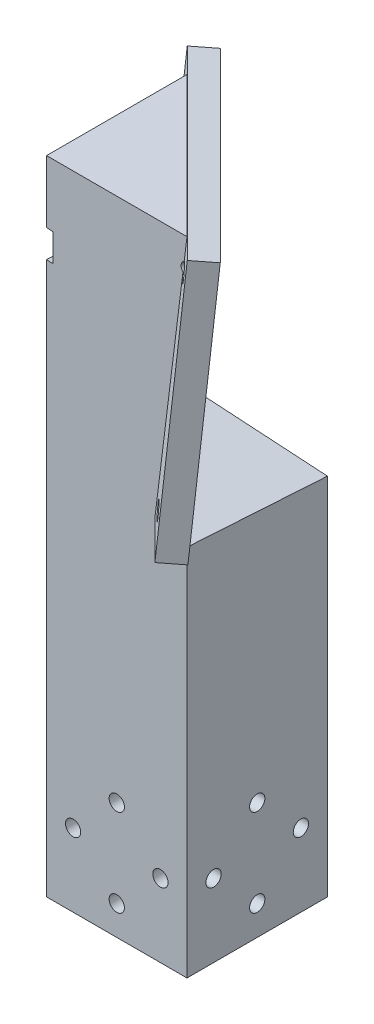
from build123d import *

# Parameters (mm, degrees)
SKETCH1_W               = 30.562599784
SKETCH1_H               = 30.562599784
BOSS_EXTRUDE1_DEPTH     = 139.7
CUT_EXTRUDE1_DEPTH      = 142.361685943
CUT_EXTRUDE1_DEPTH_BACK = 142.361685943
BOSS_EXTRUDE2_DEPTH     = 5.09983
SKETCH5_R               = 1.8
CUT_EXTRUDE2_DEPTH      = 146.354775845
SKETCH6_R               = 1.662500104
CUT_EXTRUDE3_DEPTH      = 145.138064655


with BuildPart() as part:
    # Sketch1 → Boss-Extrude1 (new body)
    with BuildSketch(Plane(origin=(0, 0, 0), x_dir=(1, 0, 0), z_dir=(0, 1, 0))):
        Rectangle(SKETCH1_W, SKETCH1_H)
    extrude(amount=BOSS_EXTRUDE1_DEPTH)

    # Sketch2 → Cut-Extrude1 (cut, two sides: drawn at the far end of the back side and taken through both)
    with BuildSketch(Plane(origin=(0, 0, 0), x_dir=(0.7071067811865477, 0, -0.7071067811865475), z_dir=(0.7071067811865475, 0, 0.7071067811865477)).offset(-CUT_EXTRUDE1_DEPTH_BACK)):
        Polygon((5.11931044, 139.7), (0, 81.186013921), (21.611021558, 79.295294527), (21.611021558, 139.7), align=None)
    extrude(amount=CUT_EXTRUDE1_DEPTH + CUT_EXTRUDE1_DEPTH_BACK, mode=Mode.SUBTRACT)

    # Sketch4 → Boss-Extrude2 (add)
    with BuildSketch(Plane(origin=(-4.984326181, 0.616698988, 4.984326181), x_dir=(-0.6990853645605906, 0.08649619246092877, -0.7097873355780225), z_dir=(0.704416026402759, -0.08715574274765817, -0.7044160264027586))):
        Polygon((-16.344826658, 141.568383735), (40.589342943, 136.606243895), (35.627203104, 79.672074294), (-21.306966498, 84.634214133), align=None)
    extrude(amount=-BOSS_EXTRUDE2_DEPTH)

    # Sketch5 → Cut-Extrude2 (cut, through all)
    with BuildSketch(Plane(origin=(-4.984326181, 0.616698988, 4.984326181), x_dir=(-0.6990853645605907, 0.08649619246092867, -0.7097873355780224), z_dir=(0.7044160264027588, -0.08715574274765812, -0.7044160264027586))):
        with Locations(Location((33.963841811, 130.554186497, 0), (0, 0, 355.018930606))):
            Circle(SKETCH5_R)
        with Locations(Location((-10.866212993, 134.461383221, 0), (0, 0, 355.018930606))):
            Circle(SKETCH5_R)
        with Locations(Location((-14.773409717, 89.631328416, 0), (0, 0, 355.018930606))):
            Circle(SKETCH5_R)
        with Locations(Location((30.056645087, 85.724131693, 0), (0, 0, 355.018930606))):
            Circle(SKETCH5_R)
        Polygon((19.712476114, 122.520420225), (9.750241713, 123.388686164), (9.22928215, 117.411345523), (19.191516551, 116.543079585), align=None)
    extrude(amount=-CUT_EXTRUDE2_DEPTH, mode=Mode.SUBTRACT)

    # Sketch6 → Cut-Extrude3 (cut, symmetric)
    with BuildSketch(Plane(origin=(0, 0, 0), x_dir=(0, 0, -1), z_dir=(1, 0, 0))):
        with Locations(Location((0, 25.4, 0), (0, 0, 180))):
            Circle(SKETCH6_R)
        with Locations(Location((-9.5, 15.9, 0), (0, 0, 180))):
            Circle(SKETCH6_R)
        with Locations(Location((9.5, 15.9, 0), (0, 0, 180))):
            Circle(SKETCH6_R)
        with Locations(Location((0, 6.4, 0), (0, 0, 180))):
            Circle(SKETCH6_R)
    cut_extrude3 = extrude(amount=CUT_EXTRUDE3_DEPTH, both=True, mode=Mode.SUBTRACT)

    # Mirror1: Cut-Extrude3 across plane
    add(cut_extrude3.mirror(Plane(origin=(0, 0, 0), x_dir=(-0.7071067811865478, 0, 0.7071067811865472), z_dir=(0.7071067811865475, 0, 0.7071067811865477))), mode=Mode.SUBTRACT)


solid = part.part
